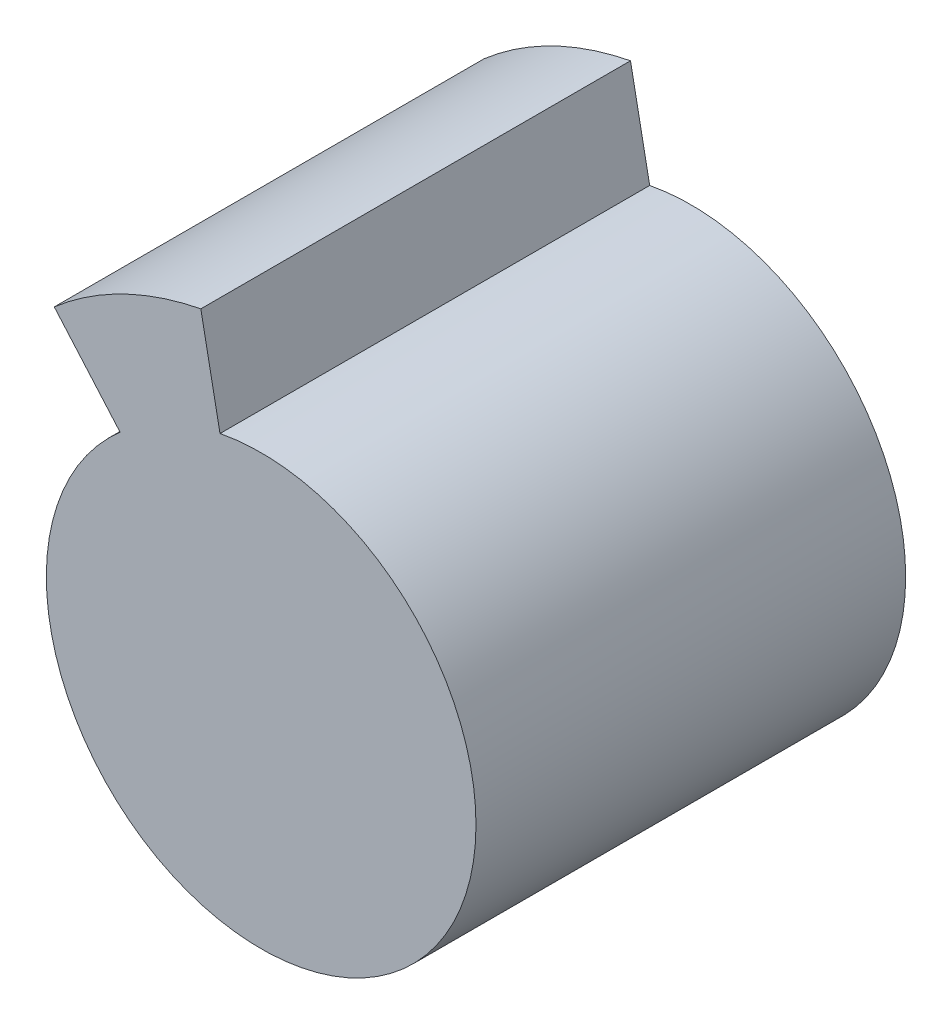
from build123d import *

# Parameters (mm, degrees)
EXTRUDE_1_DEPTH = 30


with BuildPart() as part:
    # 草图1 → 凸台-拉伸1 (new body)
    with BuildSketch(Plane.XY):
        with BuildLine():
            ThreePointArc((-34.302578181, 24.683383753), (-17.868949022, -0.107793196), (-27.326187102, 28.091981089))
            Line((-27.326187102, 28.091981089), (-28.666609487, 34.962444526))
            ThreePointArc((-28.666609487, 34.962444526), (-34.111713204, 33.136343306), (-38.898649737, 29.963168432))
            Line((-38.898649737, 29.963168432), (-34.302578181, 24.683383753))
        make_face()
    extrude(amount=EXTRUDE_1_DEPTH)


solid = part.part
